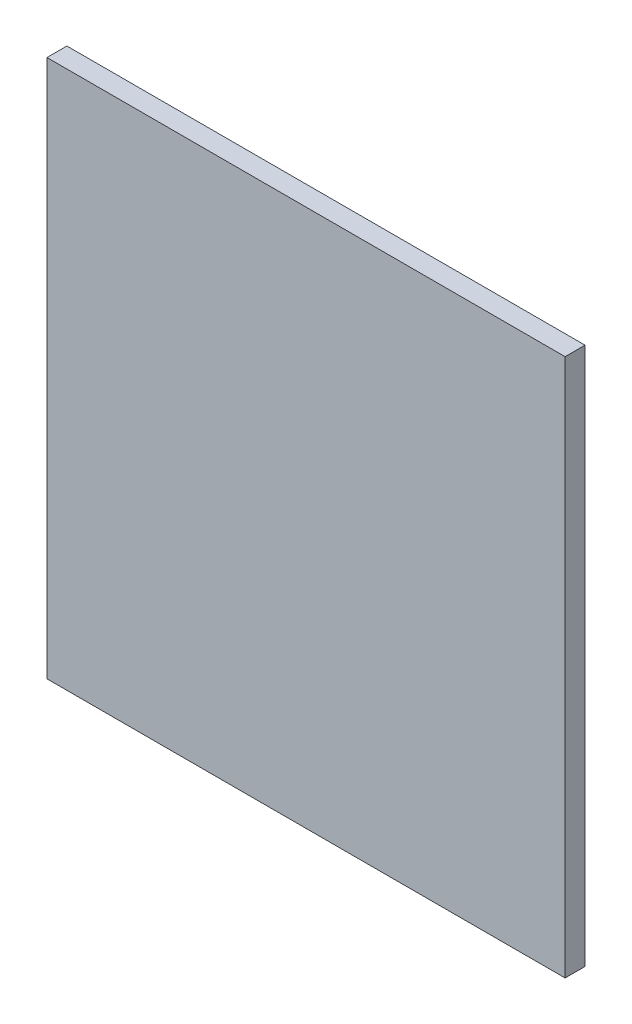
from build123d import *

# Parameters (mm, degrees)
SKETCH1_W           = 165.1
SKETCH1_H           = 171.45
BOSS_EXTRUDE1_DEPTH = 6.35


with BuildPart() as part:
    # Sketch1 → Boss-Extrude1 (new body)
    with BuildSketch(Plane.XY):
        with Locations((76.2, 69.85)):
            Rectangle(SKETCH1_W, SKETCH1_H)
    extrude(amount=BOSS_EXTRUDE1_DEPTH)


solid = part.part
